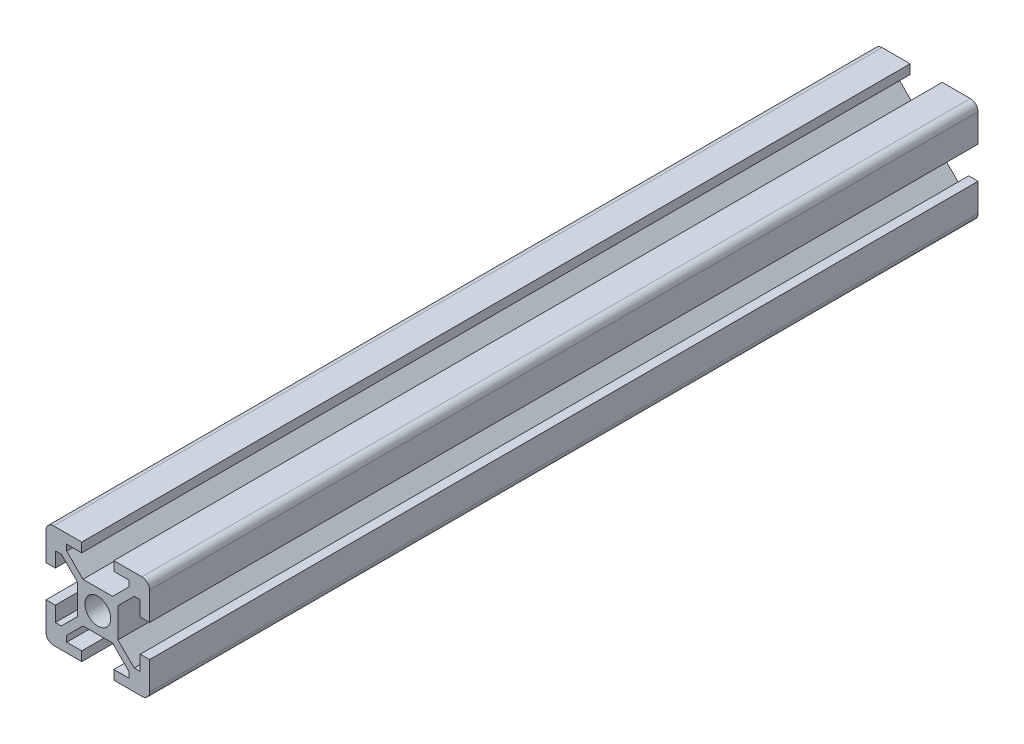
from build123d import *

# Parameters (mm, degrees)
SKETCH1_R           = 2.5
BOSS_EXTRUDE1_DEPTH = 160
FILLET1_R           = 1.47
SKETCH2_R           = 1.5
CUT_EXTRUDE1_DEPTH  = 161.913672508


with BuildPart() as part:
    # Sketch1 → Boss-Extrude1 (new body)
    with BuildSketch(Plane.XY):
        Polygon((2.860553032, 3.9), (6, 7.039446968), (6, 8.2), (3.1, 8.2), (3.1, 10), (10, 10), (10, 3.1), (8.2, 3.1), (8.2, 6), (7.039446968, 6), (3.9, 2.860553032), (3.9, 0), (3.9, -2.860553032), (7.039446968, -6), (8.2, -6), (8.2, -3.1), (10, -3.1), (10, -10), (3.1, -10), (3.1, -8.2), (6, -8.2), (6, -7.039446968), (2.860553032, -3.9), (0, -3.9), (-2.860553032, -3.9), (-6, -7.039446968), (-6, -8.2), (-3.1, -8.2), (-3.1, -10), (-10, -10), (-10, -3.1), (-8.2, -3.1), (-8.2, -6), (-7.039446968, -6), (-3.9, -2.860553032), (-3.9, 0), (-3.9, 2.860553032), (-7.039446968, 6), (-8.2, 6), (-8.2, 3.1), (-10, 3.1), (-10, 10), (-3.1, 10), (-3.1, 8.2), (-6, 8.2), (-6, 7.039446968), (-2.860553032, 3.9), (0, 3.9), align=None)
        Circle(SKETCH1_R, mode=Mode.SUBTRACT)
    extrude(amount=BOSS_EXTRUDE1_DEPTH)

    # Fillet1
    fillet1_edges = [part.edges().sort_by_distance(p)[0] for p in [
        (10, -10, 80),
        (-10, -10, 80),
        (-10, 10, 80),
        (10, 10, 80),
    ]]
    fillet(fillet1_edges, radius=FILLET1_R)

    # Sketch2 → Cut-Extrude1 (cut, through all)
    with BuildSketch(Plane(origin=(3.9, 0, 0), x_dir=(0, 0, -1), z_dir=(1, 0, 0))):
        with Locations(Location((-150, 0, 0), (0, 0, 90))):
            Circle(SKETCH2_R)
        with Locations(Location((-79.29, 0, 0), (0, 0, 90))):
            Circle(SKETCH2_R)
        with Locations(Location((-10, 0, 0), (0, 0, 90))):
            Circle(SKETCH2_R)
    extrude(amount=-CUT_EXTRUDE1_DEPTH, mode=Mode.SUBTRACT)


solid = part.part
